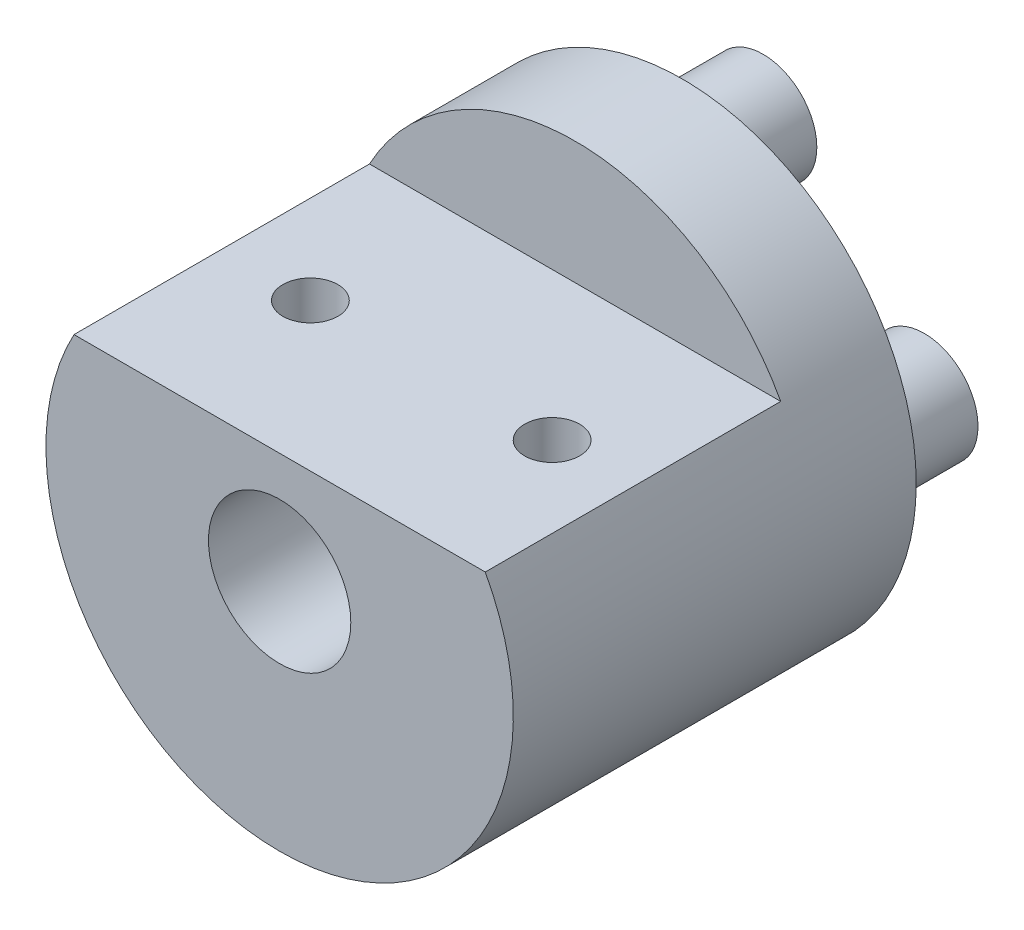
from build123d import *

# Parameters (mm, degrees)
SKETCH1_R                      = 8.7
BOSS_EXTRUDE1_DEPTH            = 15
SKETCH5_R                      = 1.75
CUT_EXTRUDE1_DEPTH             = 20.400515457
SKETCH6_R                      = 2.65
CUT_EXTRUDE3_DEPTH             = 6.4
SKETCH2_W                      = 17
SKETCH2_H                      = 4.566888769
CUT_EXTRUDE4_DEPTH             = 11
FILLET1_R                      = 0.3
TAP_DRILL_FOR_M2_5X0_45_TAP2_D = 2.05
SKETCH4_R                      = 2
BOSS_EXTRUDE2_DEPTH            = 3


with BuildPart() as part:
    # Sketch1 → Boss-Extrude1 (new body)
    with BuildSketch(Plane.XY):
        Circle(SKETCH1_R)
    extrude(amount=BOSS_EXTRUDE1_DEPTH)

    # Sketch5 → Cut-Extrude1 (cut, through all)
    with BuildSketch(Plane(origin=(0, 0, 0), x_dir=(-1, 0, 0), z_dir=(0, 0, -1))):
        Circle(SKETCH5_R)
    extrude(amount=-CUT_EXTRUDE1_DEPTH, mode=Mode.SUBTRACT)

    # Sketch6 → Cut-Extrude3 (cut)
    with BuildSketch(Plane.XY.offset(15)):
        Circle(SKETCH6_R)
    extrude(amount=-CUT_EXTRUDE3_DEPTH, mode=Mode.SUBTRACT)

    # Sketch2 → Cut-Extrude4 (cut)
    with BuildSketch(Plane.XY.offset(15)):
        with Locations((0.844453543, 6.416555616)):
            Rectangle(SKETCH2_W, SKETCH2_H)
    extrude(amount=-CUT_EXTRUDE4_DEPTH, mode=Mode.SUBTRACT)

    # Fillet1
    fillet1_edges = [part.edges().sort_by_distance(p)[0] for p in [
        (1.75, 0, 8.6),
    ]]
    fillet(fillet1_edges, radius=FILLET1_R)

    # Tap Drill for M2.5x0.45 Tap2 (through all)
    with Locations(Plane(origin=(0, 4.133111231, 0), x_dir=(1, 0, 0), z_dir=(0, 1, 0))):
        with Locations((-4.355546457, -9.5), (4.644453543, -9.5)):
            Hole(TAP_DRILL_FOR_M2_5X0_45_TAP2_D / 2)

    # Sketch4 → Boss-Extrude2 (add)
    with BuildSketch(Plane(origin=(0, 0, 0), x_dir=(-1, 0, 0), z_dir=(0, 0, -1))):
        with Locations(Location((0, 6, 0), (0, 0, 180))):
            Circle(SKETCH4_R)
        with Locations(Location((6, 0, 0), (0, 0, 180))):
            Circle(SKETCH4_R)
        with Locations(Location((0, -6, 0), (0, 0, 180))):
            Circle(SKETCH4_R)
        with Locations(Location((-6, 0, 0), (0, 0, 180))):
            Circle(SKETCH4_R)
    extrude(amount=BOSS_EXTRUDE2_DEPTH)


solid = part.part
